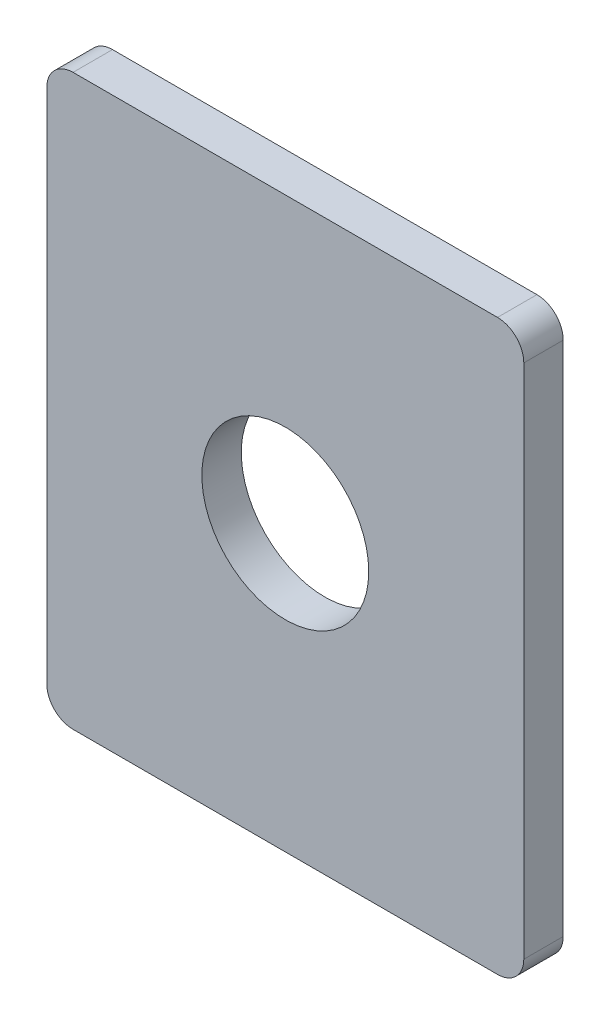
from build123d import *

# Parameters (mm, degrees)
SKETCH1_W           = 36.3
SKETCH1_H           = 43.3
SKETCH1_R           = 6.35
BOSS_EXTRUDE1_DEPTH = 3
FILLET1_R           = 2


with BuildPart() as part:
    # Sketch1 → Boss-Extrude1 (new body)
    with BuildSketch(Plane.XY):
        Rectangle(SKETCH1_W, SKETCH1_H)
        Circle(SKETCH1_R, mode=Mode.SUBTRACT)
    extrude(amount=BOSS_EXTRUDE1_DEPTH)

    # Fillet1
    fillet1_edges = [part.edges().sort_by_distance(p)[0] for p in [
        (18.15, -21.65, 1.5),
        (-18.15, -21.65, 1.5),
        (-18.15, 21.65, 1.5),
        (18.15, 21.65, 1.5),
    ]]
    fillet(fillet1_edges, radius=FILLET1_R)


solid = part.part
